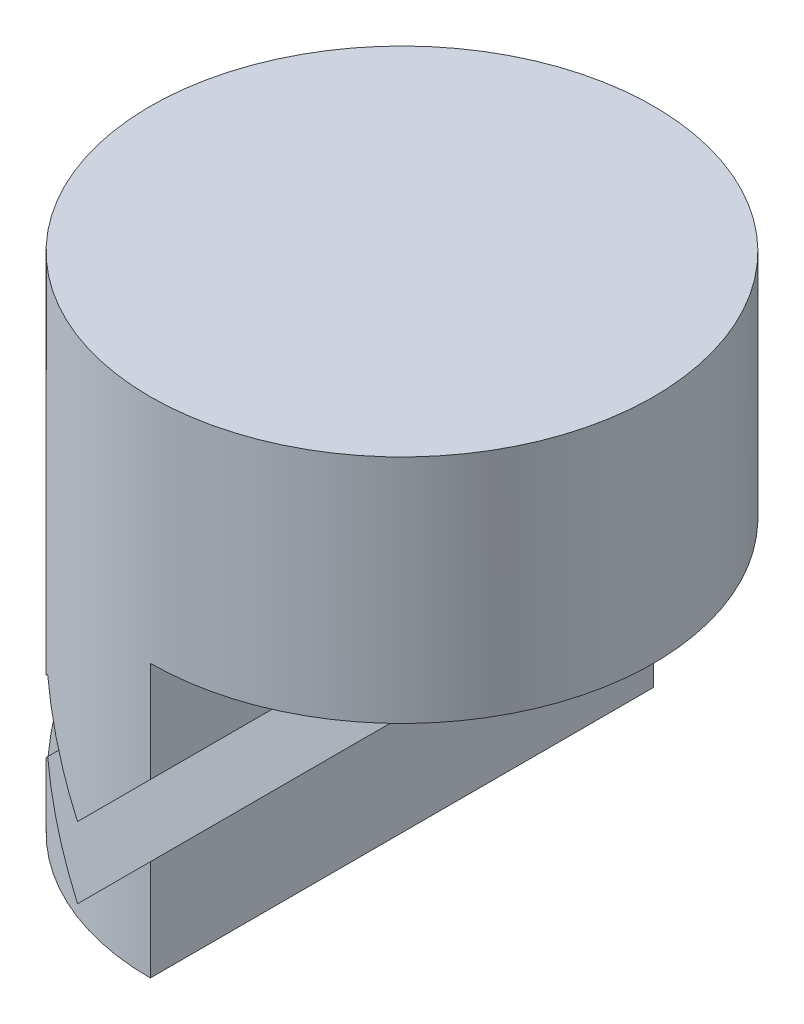
from build123d import *

# Parameters (mm, degrees)
SKETCH_1_R               = 50
EXTRUDE_1_DEPTH          = 100
CUT_EXTRUDE_1_DEPTH      = 123.474487139
CUT_EXTRUDE_1_DEPTH_BACK = 123.474487139


with BuildPart() as part:
    # 草图1 → 凸台-拉伸1 (new body)
    with BuildSketch(Plane(origin=(0, 0, 0), x_dir=(1, 0, 0), z_dir=(0, 1, 0))):
        with Locations(Location((0, 0, 0), (0, 0, 270))):
            Circle(SKETCH_1_R)
    extrude(amount=EXTRUDE_1_DEPTH)

    # 草图2 → 切除-拉伸1 (cut, two sides: drawn at the far end of the back side and taken through both)
    with BuildSketch(Plane.XY.offset(-CUT_EXTRUDE_1_DEPTH_BACK)):
        Polygon((0, 0), (0, 20), (-17.67766953, 2.32233047), (-31.819805153, 16.464466094), (-38.890872965, 9.393398282), (-45.961940777, 16.464466094), (-31.843330798, 30.583076073), (-17.701195174, 16.440940449), (0, 34.142135624), (0, 54.142135624), (63.983037585, 54.142135624), (63.983037585, 0), align=None)
    extrude(amount=CUT_EXTRUDE_1_DEPTH + CUT_EXTRUDE_1_DEPTH_BACK, mode=Mode.SUBTRACT)


solid = part.part
